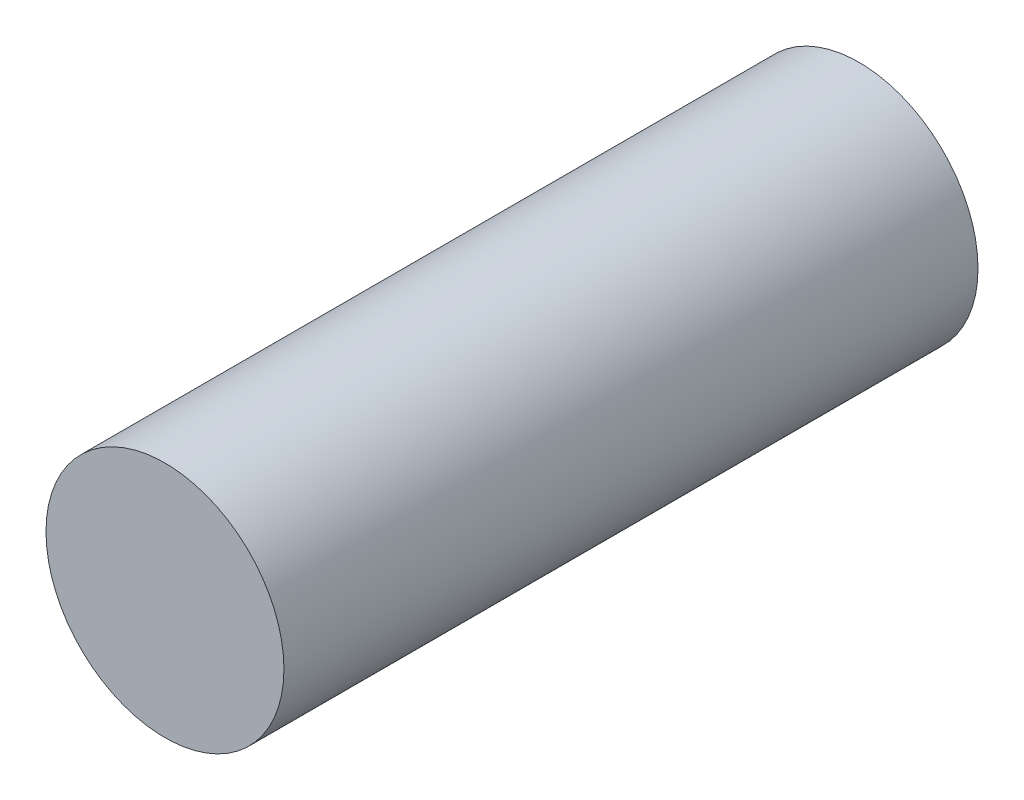
from build123d import *

# Parameters (mm, degrees)
SKETCH1_R           = 6
BOSS_EXTRUDE1_DEPTH = 35


with BuildPart() as part:
    # Sketch1 → Boss-Extrude1 (new body)
    with BuildSketch(Plane.XY):
        Circle(SKETCH1_R)
    extrude(amount=BOSS_EXTRUDE1_DEPTH)


solid = part.part
